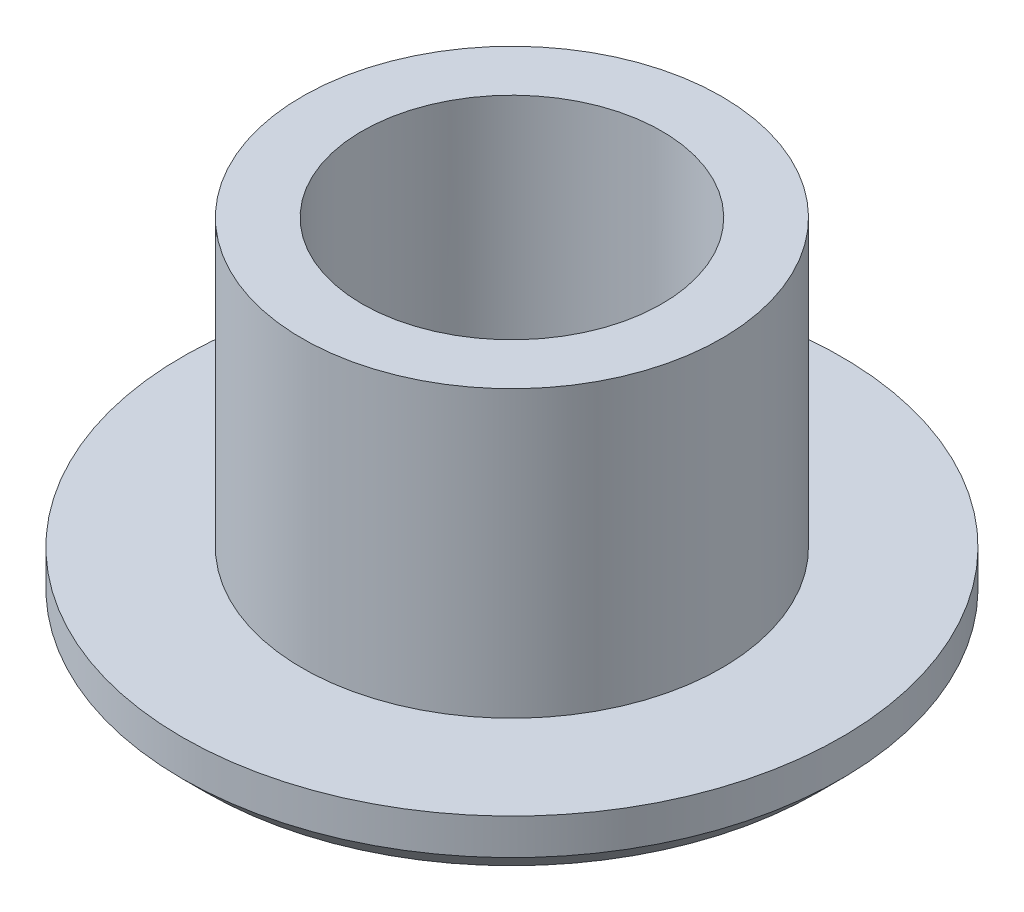
from build123d import *

# Parameters (mm, degrees)
SKETCH1_R           = 5.5
BOSS_EXTRUDE1_DEPTH = 1
SKETCH2_R           = 3.5
BOSS_EXTRUDE2_DEPTH = 4.7625
SKETCH3_R           = 2.5
CUT_EXTRUDE1_DEPTH  = 10.680206932
CHAMFER1_SIZE       = 0.4


with BuildPart() as part:
    # Sketch1 → Boss-Extrude1 (new body)
    with BuildSketch(Plane(origin=(0, 0, 0), x_dir=(1, 0, 0), z_dir=(0, 1, 0))):
        with Locations(Location((0, 0, 0), (0, 0, 270))):
            Circle(SKETCH1_R)
    extrude(amount=BOSS_EXTRUDE1_DEPTH)

    # Sketch2 → Boss-Extrude2 (add)
    with BuildSketch(Plane(origin=(0, 1, 0), x_dir=(1, 0, 0), z_dir=(0, 1, 0))):
        with Locations(Location((0, 0, 0), (0, 0, 90))):
            Circle(SKETCH2_R)
    extrude(amount=BOSS_EXTRUDE2_DEPTH)

    # Sketch3 → Cut-Extrude1 (cut, through all)
    with BuildSketch(Plane(origin=(0, 5.7625, 0), x_dir=(1, 0, 0), z_dir=(0, 1, 0))):
        with Locations(Location((0, 0, 0), (0, 0, 270))):
            Circle(SKETCH3_R)
    extrude(amount=-CUT_EXTRUDE1_DEPTH, mode=Mode.SUBTRACT)

    # Chamfer1
    chamfer1_edges = [part.edges().sort_by_distance(p)[0] for p in [
        (0, 0, -2.5),
        (0, 0, -5.5),
    ]]
    chamfer(chamfer1_edges, length=CHAMFER1_SIZE)


solid = part.part
